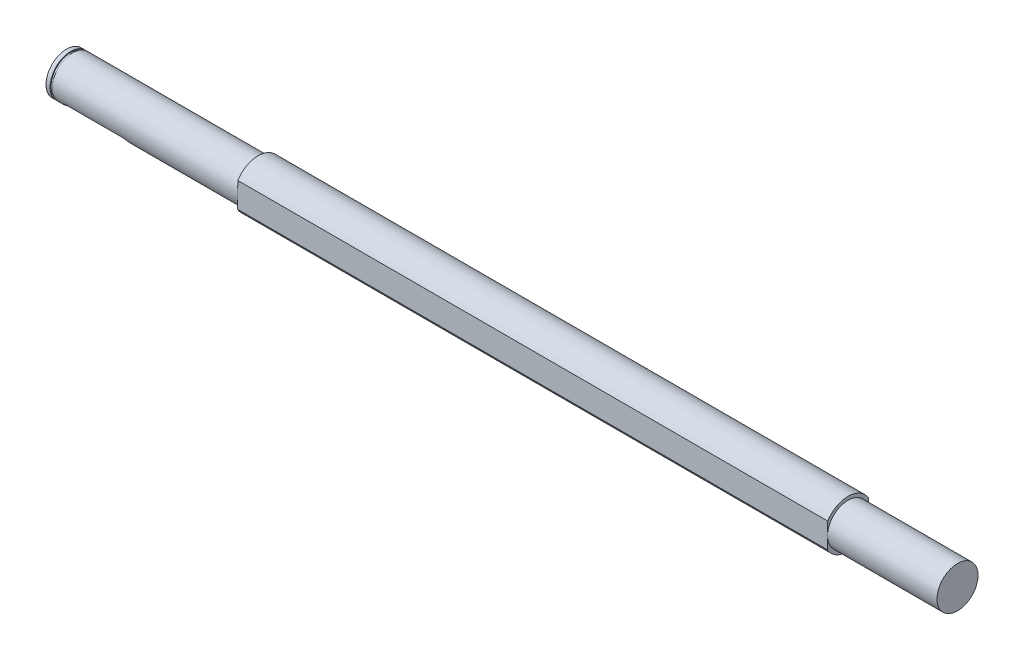
from build123d import *

# Parameters (mm, degrees)
KES_EKSTR_ZYON1_DEPTH = 431
IZIM3_W               = 1.6
IZIM3_H               = 0.7
KES_EKSTR_ZYON2_DEPTH = 5


with BuildPart() as part:
    # Çizim1 → Döndür1 (revolve)
    with BuildSketch(Plane.XY, mode=Mode.PRIVATE) as d_nd_r1_sk:
        Polygon((-325.5, 0), (325.5, 0), (325.5, 15), (245.5, 15), (245.5, 17.5), (-185.5, 17.5), (-185.5, 15), (-325.5, 15), align=None)
    revolve(d_nd_r1_sk.sketch.rotate(Axis((-325.5, 0, 0), (1, 0, 0)), 90), axis=Axis((-325.5, 0, 0), (1, 0, 0)))

    # Çizim2 → Kes-Ekstrüzyon1 (cut)
    with BuildSketch(Plane.ZY.offset(185.5)):
        with BuildLine():
            Line((-14.843898339, 9.268693657), (-15.15172785, -8.756434386))
            ThreePointArc((-15.15172785, -8.756434386), (-17.49744861, 0.298817908), (-14.843898339, 9.268693657))
        make_face()
        with BuildLine():
            Line((14.843898339, 9.268693657), (15.15172785, -8.756434386))
            ThreePointArc((15.15172785, -8.756434386), (17.49744861, 0.298817908), (14.843898339, 9.268693657))
        make_face()
    extrude(amount=-KES_EKSTR_ZYON1_DEPTH, mode=Mode.SUBTRACT)

    # Çizim3 → Kes-Döndür2 (revolve, cut)
    with BuildSketch(Plane(origin=(0, 0, 0), x_dir=(1, 0, 0), z_dir=(0, 1, 0)), mode=Mode.PRIVATE) as kes_d_nd_r2_sk:
        with Locations((-321.7, 14.65)):
            Rectangle(IZIM3_W, IZIM3_H)
    revolve(kes_d_nd_r2_sk.sketch.rotate(Axis((-325.5, 0, 0), (1, 0, 0)), 180), axis=Axis((-325.5, 0, 0), (1, 0, 0)), mode=Mode.SUBTRACT)

    # Çizim6 → Kes-Ekstrüzyon2 (cut)
    with BuildSketch(Plane(origin=(0, -11.490666647, 9.641814145), x_dir=(0, -0.642787609686535, -0.7660444431189818), z_dir=(0, 0.7660444431189817, -0.6427876096865349))):
        with BuildLine():
            Line((5, 312.5), (5, 272.5))
            ThreePointArc((5, 272.5), (0, 267.5), (-5, 272.5))
            Line((-5, 272.5), (-5, 312.5))
            ThreePointArc((-5, 312.5), (0, 317.5), (5, 312.5))
        make_face()
    extrude(amount=KES_EKSTR_ZYON2_DEPTH, mode=Mode.SUBTRACT)


solid = part.part
